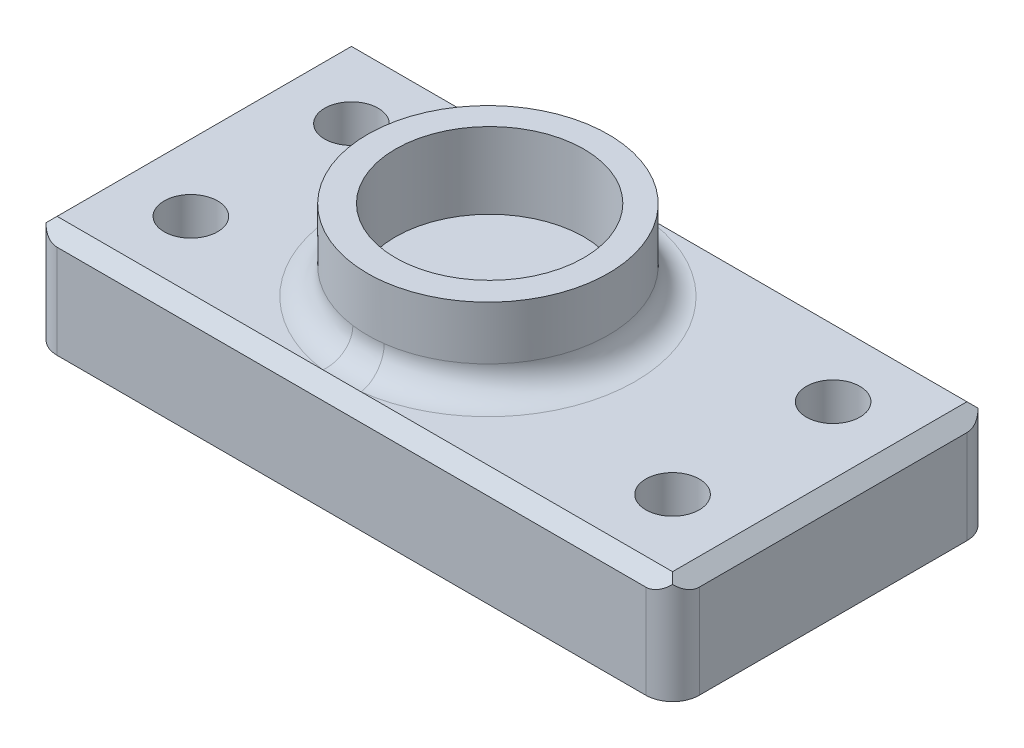
from build123d import *

# Parameters (mm, degrees)
SKETCH3_W           = 152.4
SKETCH3_H           = 76.2
BOSS_EXTRUDE2_DEPTH = 25.4
SKETCH4_R           = 6.35
CUT_EXTRUDE1_DEPTH  = 97.416192211
SKETCH5_R           = 28.575
BOSS_EXTRUDE3_DEPTH = 19.05
SKETCH6_R           = 22.353274987
CUT_EXTRUDE3_DEPTH  = 18.034
CHAMFER1_SIZE       = 3.175
FILLET1_R           = 6.35


with BuildPart() as part:
    # Sketch3 → Boss-Extrude2 (new body)
    with BuildSketch(Plane(origin=(0, 0, 0), x_dir=(1, 0, 0), z_dir=(0, 1, 0))):
        with Locations((6.742008695, 3.989729317)):
            Rectangle(SKETCH3_W, SKETCH3_H)
    extrude(amount=BOSS_EXTRUDE2_DEPTH)

    # Sketch4 → Cut-Extrude1 (cut, through all)
    with BuildSketch(Plane(origin=(0, 25.4, 0), x_dir=(1, 0, 0), z_dir=(0, 1, 0))):
        with Locations(Location((-50.407991305, 23.039729317, 0), (0, 0, 270))):
            Circle(SKETCH4_R)
        with Locations(Location((-50.407991305, -15.060270683, 0), (0, 0, 270))):
            Circle(SKETCH4_R)
        with Locations(Location((63.892008695, 23.039729317, 0), (0, 0, 270))):
            Circle(SKETCH4_R)
        with Locations(Location((63.892008695, -15.060270683, 0), (0, 0, 270))):
            Circle(SKETCH4_R)
    extrude(amount=-CUT_EXTRUDE1_DEPTH, mode=Mode.SUBTRACT)

    # Sketch5 → Boss-Extrude3 (add)
    with BuildSketch(Plane(origin=(0, 25.4, 0), x_dir=(1, 0, 0), z_dir=(0, 1, 0))):
        with Locations(Location((1.327722903, 3.693056123, 0), (0, 0, 90))):
            Circle(SKETCH5_R)
    extrude(amount=BOSS_EXTRUDE3_DEPTH)

    # Sketch6 → Cut-Extrude3 (cut)
    with BuildSketch(Plane(origin=(0, 44.45, 0), x_dir=(1, 0, 0), z_dir=(0, 1, 0))):
        with Locations(Location((1.440777923, 3.989157158, 0), (0, 0, 270))):
            Circle(SKETCH6_R)
    extrude(amount=-CUT_EXTRUDE3_DEPTH, mode=Mode.SUBTRACT)

    # Chamfer1
    chamfer1_edges = [part.edges().sort_by_distance(p)[0] for p in [
        (82.942008695, 25.4, -3.989729317),
        (6.742008695, 25.4, -42.089729317),
        (-69.457991305, 25.4, -3.989729317),
        (6.742008695, 25.4, 34.110270683),
    ]]
    chamfer(chamfer1_edges, length=CHAMFER1_SIZE)

    # Fillet1
    fillet1_edges = [part.edges().sort_by_distance(p)[0] for p in [
        (1.327722903, 25.4, 24.881943877),
        (-69.457991305, 11.1125, 34.110270683),
        (-69.457991305, 11.1125, -42.089729317),
        (82.942008695, 11.1125, -42.089729317),
        (82.942008695, 11.1125, 34.110270683),
    ]]
    fillet(fillet1_edges, radius=FILLET1_R)


solid = part.part
